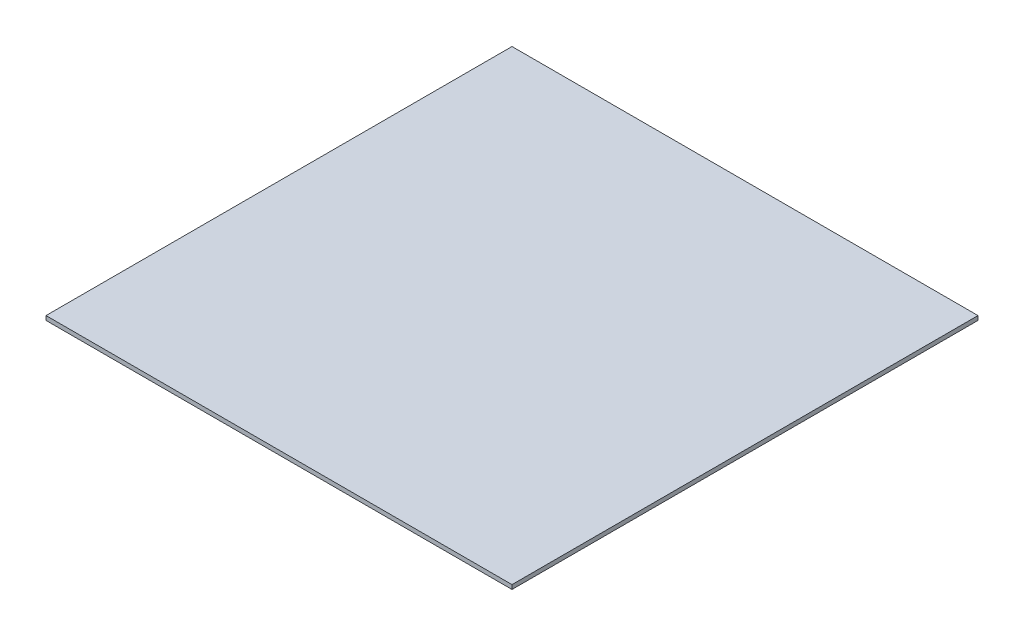
from build123d import *

# Parameters (mm, degrees)
SKETCH1_W           = 279.4
SKETCH1_H           = 279.4
BOSS_EXTRUDE1_DEPTH = 2.54


with BuildPart() as part:
    # Sketch1 → Boss-Extrude1 (new body)
    with BuildSketch(Plane(origin=(0, 0, 0), x_dir=(1, 0, 0), z_dir=(0, 1, 0))):
        Rectangle(SKETCH1_W, SKETCH1_H)
    extrude(amount=BOSS_EXTRUDE1_DEPTH)


solid = part.part
